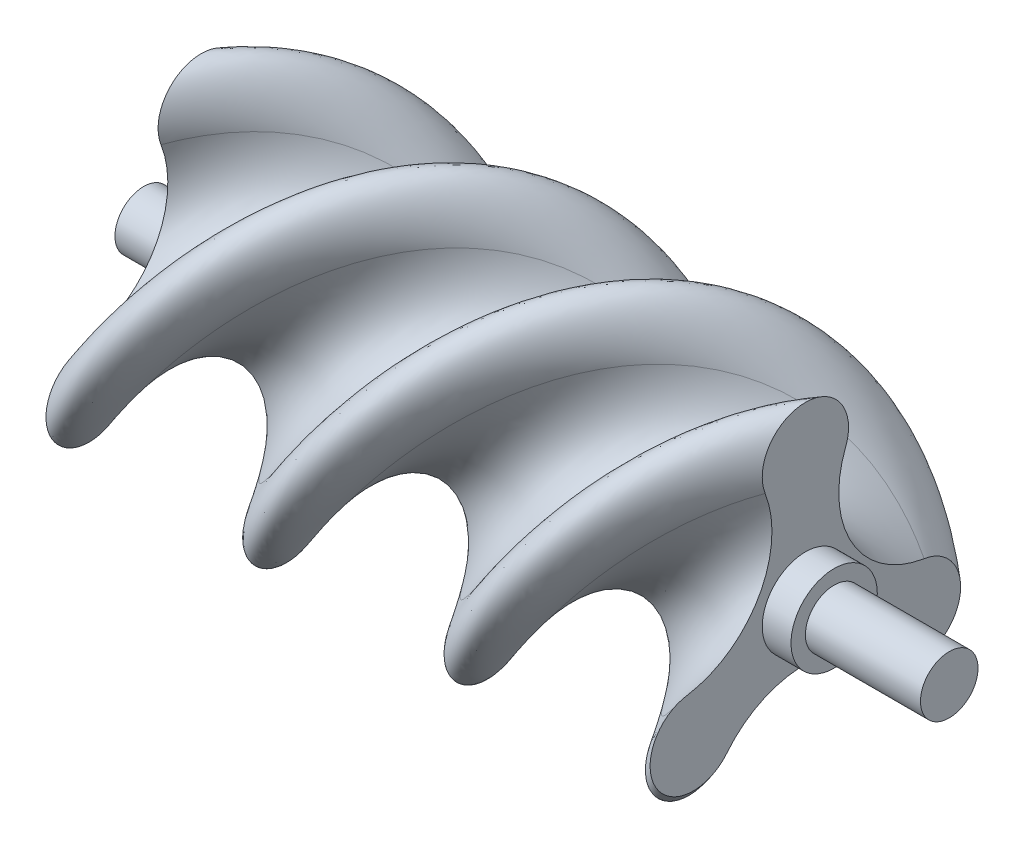
from build123d import *

# Parameters (mm, degrees)
SWEEP1_PITCH             = 210
SWEEP1_HEIGHT            = 210
SWEEP1_RADIUS            = 60
SWEEP1_START_ANGLE       = -90
BOSS_EXTRUDE1_DEPTH      = 50
BOSS_EXTRUDE1_DEPTH_BACK = 230
SKETCH3_R                = 10
SKETCH4_R                = 15
BOSS_EXTRUDE2_DEPTH      = 10
BOSS_EXTRUDE3_DEPTH      = 10


with BuildPart() as part:
    # Sweep1: sweep along a helix
    with BuildLine() as sweep1_path:
        add(Helix(SWEEP1_PITCH, SWEEP1_HEIGHT, SWEEP1_RADIUS, center=(0, 0, 0), direction=(1, 0, 0), lefthand=True, mode=Mode.PRIVATE).rotate(Axis((0, 0, 0), (1, 0, 0)), SWEEP1_START_ANGLE))
    # Sketch1 → Sweep1 (sweep)
    with BuildSketch(Plane(origin=(0, 0, 0), x_dir=(0, 0, -1), z_dir=(1, 0, 0))):
        with BuildLine():
            ThreePointArc((13.984121881, 39.573736532), (0, 60), (-13.984121881, 39.573736532))
            ThreePointArc((-13.984121881, 39.573736532), (-16.30285047, 9.412455108), (-41.2639221, -7.676263468))
            ThreePointArc((-41.2639221, -7.676263468), (-51.961524227, -30), (-27.279800219, -31.897473065))
            ThreePointArc((-27.279800219, -31.897473065), (0, -18.824910215), (27.279800219, -31.897473065))
            ThreePointArc((27.279800219, -31.897473065), (51.961524227, -30), (41.2639221, -7.676263468))
            ThreePointArc((41.2639221, -7.676263468), (16.30285047, 9.412455108), (13.984121881, 39.573736532))
        make_face()
    sweep(path=sweep1_path.line, is_frenet=True)

    # Sketch3 → Boss-Extrude1 (add, two sides: drawn at the far end of the back side and taken through both)
    with BuildSketch(Plane(origin=(210, 0, 0), x_dir=(0, 0, -1), z_dir=(1, 0, 0)).offset(-BOSS_EXTRUDE1_DEPTH_BACK)):
        Circle(SKETCH3_R)
    extrude(amount=BOSS_EXTRUDE1_DEPTH + BOSS_EXTRUDE1_DEPTH_BACK)

    # Sketch4 → Boss-Extrude2 (add)
    with BuildSketch(Plane(origin=(210, 0, 0), x_dir=(0, 0, -1), z_dir=(1, 0, 0))):
        Circle(SKETCH4_R)
    extrude(amount=BOSS_EXTRUDE2_DEPTH)

    # Sketch5 → Boss-Extrude3 (add)
    with BuildSketch(Plane(origin=(220, 0, 0), x_dir=(0, 0, -1), z_dir=(1, 0, 0))):
        Polygon((6.066543677, 2.048669767), (12.644392023, -0.345471237), (9.908230876, -7.863012203), (3.330382531, -5.4688712), align=None)
    extrude(amount=BOSS_EXTRUDE3_DEPTH)


solid = part.part
